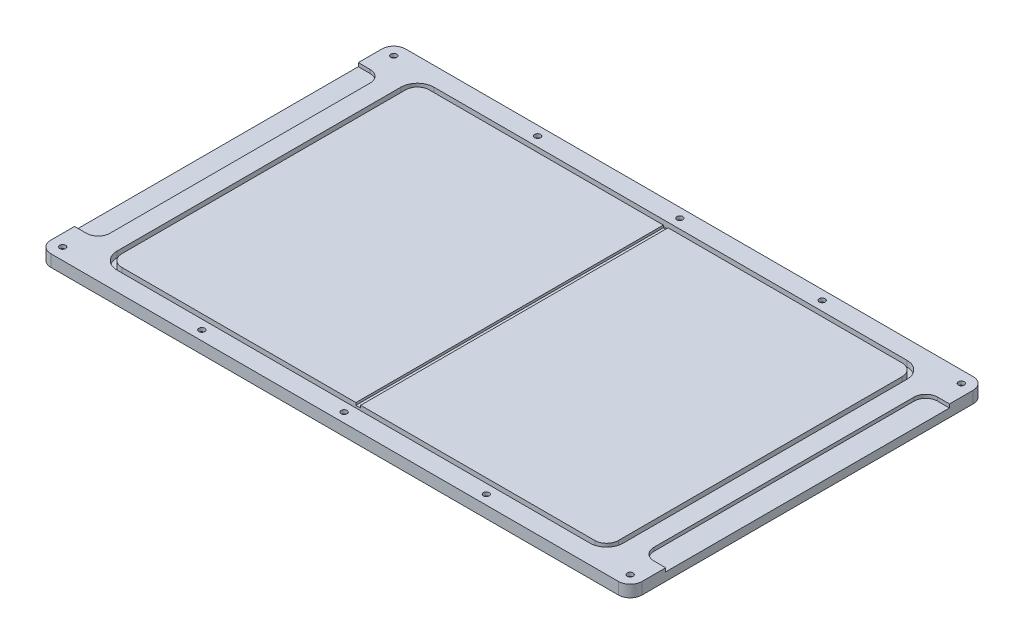
from build123d import *

# Parameters (mm, degrees)
EXTRUDE_1_DEPTH     = 5
CUT_EXTRUDE_1_DEPTH = 1.5
CUT_EXTRUDE_2_DEPTH = 2.5
SKETCH_4_R          = 1.25
CUT_EXTRUDE_3_DEPTH = 5
SKETCH_5_R          = 2.85
CUT_EXTRUDE_4_DEPTH = 3.5
SKETCH_6_R          = 1.25
CUT_EXTRUDE_5_DEPTH = 5
SKETCH_7_R          = 2.85
CUT_EXTRUDE_6_DEPTH = 3.5
SKETCH_8_W          = 2
SKETCH_8_H          = 130
CUT_EXTRUDE_8_DEPTH = 1


with BuildPart() as part:
    # 草图1 → 凸台-拉伸1 (new body)
    with BuildSketch(Plane(origin=(0, 0, 0), x_dir=(1, 0, 0), z_dir=(0, 1, 0))):
        with BuildLine():
            Line((-120, 75), (120, 75))
            ThreePointArc((120, 75), (123.535533906, 73.535533906), (125, 70))
            Line((125, 70), (125, -70))
            ThreePointArc((125, -70), (123.535533906, -73.535533906), (120, -75))
            Line((120, -75), (-120, -75))
            ThreePointArc((-120, -75), (-123.535533906, -73.535533906), (-125, -70))
            Line((-125, -70), (-125, 70))
            ThreePointArc((-125, 70), (-123.535533906, 73.535533906), (-120, 75))
        make_face()
    extrude(amount=EXTRUDE_1_DEPTH)

    # 草图2 → 切除-拉伸1 (cut)
    with BuildSketch(Plane(origin=(0, 5, 0), x_dir=(1, 0, 0), z_dir=(0, 1, 0))):
        with BuildLine():
            Line((-125, 60), (-120, 60))
            ThreePointArc((-120, 60), (-116.464466094, 58.535533906), (-115, 55))
            Line((-115, 55), (-115, -55))
            ThreePointArc((-115, -55), (-116.464466094, -58.535533906), (-120, -60))
            Line((-120, -60), (-125, -60))
            Line((-125, -60), (-125, 60))
        make_face()
        with BuildLine():
            Line((115, 55), (115, -55))
            ThreePointArc((115, -55), (116.464466094, -58.535533906), (120, -60))
            Line((120, -60), (125, -60))
            Line((125, -60), (125, 60))
            Line((125, 60), (120, 60))
            ThreePointArc((120, 60), (116.464466094, 58.535533906), (115, 55))
        make_face()
    extrude(amount=-CUT_EXTRUDE_1_DEPTH, mode=Mode.SUBTRACT)

    # 草图3 → 切除-拉伸2 (cut)
    with BuildSketch(Plane(origin=(0, 5, 0), x_dir=(1, 0, 0), z_dir=(0, 1, 0))):
        with BuildLine():
            Line((-100, 67), (100, 67))
            ThreePointArc((100, 67), (104.949747468, 64.949747468), (107, 60))
            Line((107, 60), (107, -60))
            ThreePointArc((107, -60), (104.949747468, -64.949747468), (100, -67))
            Line((100, -67), (-100, -67))
            ThreePointArc((-100, -67), (-104.949747468, -64.949747468), (-107, -60))
            Line((-107, -60), (-107, 60))
            ThreePointArc((-107, 60), (-104.949747468, 64.949747468), (-100, 67))
        make_face()
        with BuildLine():
            Line((-100, 65), (100, 65))
            ThreePointArc((100, 65), (103.535533906, 63.535533906), (105, 60))
            Line((105, 60), (105, -60))
            ThreePointArc((105, -60), (103.535533906, -63.535533906), (100, -65))
            Line((100, -65), (-100, -65))
            ThreePointArc((-100, -65), (-103.535533906, -63.535533906), (-105, -60))
            Line((-105, -60), (-105, 60))
            ThreePointArc((-105, 60), (-103.535533906, 63.535533906), (-100, 65))
        make_face(mode=Mode.SUBTRACT)
    extrude(amount=-CUT_EXTRUDE_2_DEPTH, mode=Mode.SUBTRACT)

    # 草图4 → 切除-拉伸3 (cut)
    with BuildSketch(Plane.XZ):
        with Locations(Location((-120, 70, 0), (0, 0, 270))):
            Circle(SKETCH_4_R)
        with Locations(Location((-120, -70, 0), (0, 0, 270))):
            Circle(SKETCH_4_R)
        with Locations(Location((120, -70, 0), (0, 0, 270))):
            Circle(SKETCH_4_R)
        with Locations(Location((120, 70, 0), (0, 0, 270))):
            Circle(SKETCH_4_R)
    extrude(amount=-CUT_EXTRUDE_3_DEPTH, mode=Mode.SUBTRACT)

    # 草图5 → 切除-拉伸4 (cut)
    with BuildSketch(Plane.XZ):
        with Locations(Location((-120, 70, 0), (0, 0, 270))):
            Circle(SKETCH_5_R)
        with Locations(Location((-120, -70, 0), (0, 0, 270))):
            Circle(SKETCH_5_R)
        with Locations(Location((120, -70, 0), (0, 0, 270))):
            Circle(SKETCH_5_R)
        with Locations(Location((120, 70, 0), (0, 0, 270))):
            Circle(SKETCH_5_R)
    extrude(amount=-CUT_EXTRUDE_4_DEPTH, mode=Mode.SUBTRACT)

    # 草图6 → 切除-拉伸5 (cut)
    with BuildSketch(Plane(origin=(0, 5, 0), x_dir=(1, 0, 0), z_dir=(0, 1, 0))):
        with Locations(Location((0, 71, 0), (0, 0, 270))):
            Circle(SKETCH_6_R)
        with Locations(Location((-60.164669271, 71, 0), (0, 0, 270))):
            Circle(SKETCH_6_R)
        with Locations(Location((60.164669271, 71, 0), (0, 0, 90))):
            Circle(SKETCH_6_R)
        with Locations(Location((60.164669271, -71, 0), (0, 0, 270))):
            Circle(SKETCH_6_R)
        with Locations(Location((-60.164669271, -71, 0), (0, 0, 90))):
            Circle(SKETCH_6_R)
        with Locations(Location((0, -71, 0), (0, 0, 90))):
            Circle(SKETCH_6_R)
    extrude(amount=-CUT_EXTRUDE_5_DEPTH, mode=Mode.SUBTRACT)

    # 草图7 → 切除-拉伸6 (cut)
    with BuildSketch(Plane.XZ):
        with Locations(Location((-60.164669271, 71, 0), (0, 0, 270))):
            Circle(SKETCH_7_R)
        with Locations(Location((0, 71, 0), (0, 0, 270))):
            Circle(SKETCH_7_R)
        with Locations(Location((60.164669271, 71, 0), (0, 0, 270))):
            Circle(SKETCH_7_R)
        with Locations(Location((60.164669271, -71, 0), (0, 0, 90))):
            Circle(SKETCH_7_R)
        with Locations(Location((0, -71, 0), (0, 0, 90))):
            Circle(SKETCH_7_R)
        with Locations(Location((-60.164669271, -71, 0), (0, 0, 90))):
            Circle(SKETCH_7_R)
    extrude(amount=-CUT_EXTRUDE_6_DEPTH, mode=Mode.SUBTRACT)

    # 草图8 → 切除-拉伸8 (cut)
    with BuildSketch(Plane(origin=(0, 5, 0), x_dir=(1, 0, 0), z_dir=(0, 1, 0))):
        Rectangle(SKETCH_8_W, SKETCH_8_H)
    extrude(amount=-CUT_EXTRUDE_8_DEPTH, mode=Mode.SUBTRACT)


solid = part.part
